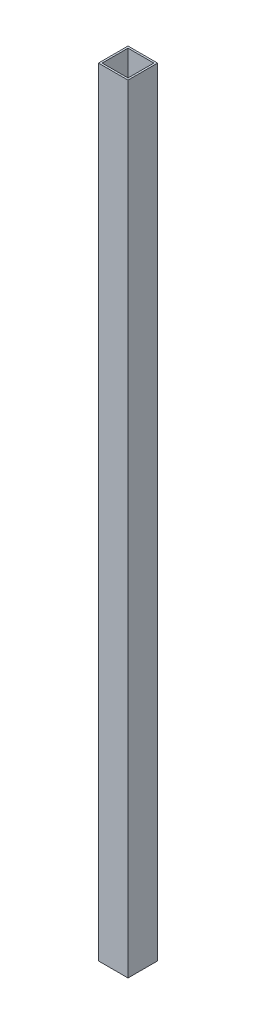
from build123d import *

# Parameters (mm, degrees)
SKETCH2_W           = 19
SKETCH2_H           = 19
SKETCH2_W_2         = 16.6
SKETCH2_H_2         = 16.6
BOSS_EXTRUDE1_DEPTH = 250


with BuildPart() as part:
    # Sketch2 → Boss-Extrude1 (new, symmetric)
    with BuildSketch(Plane(origin=(0, 0, 0), x_dir=(1, 0, 0), z_dir=(0, 1, 0))):
        Rectangle(SKETCH2_W, SKETCH2_H)
        Rectangle(SKETCH2_W_2, SKETCH2_H_2, mode=Mode.SUBTRACT)
    extrude(amount=BOSS_EXTRUDE1_DEPTH, both=True)


solid = part.part
